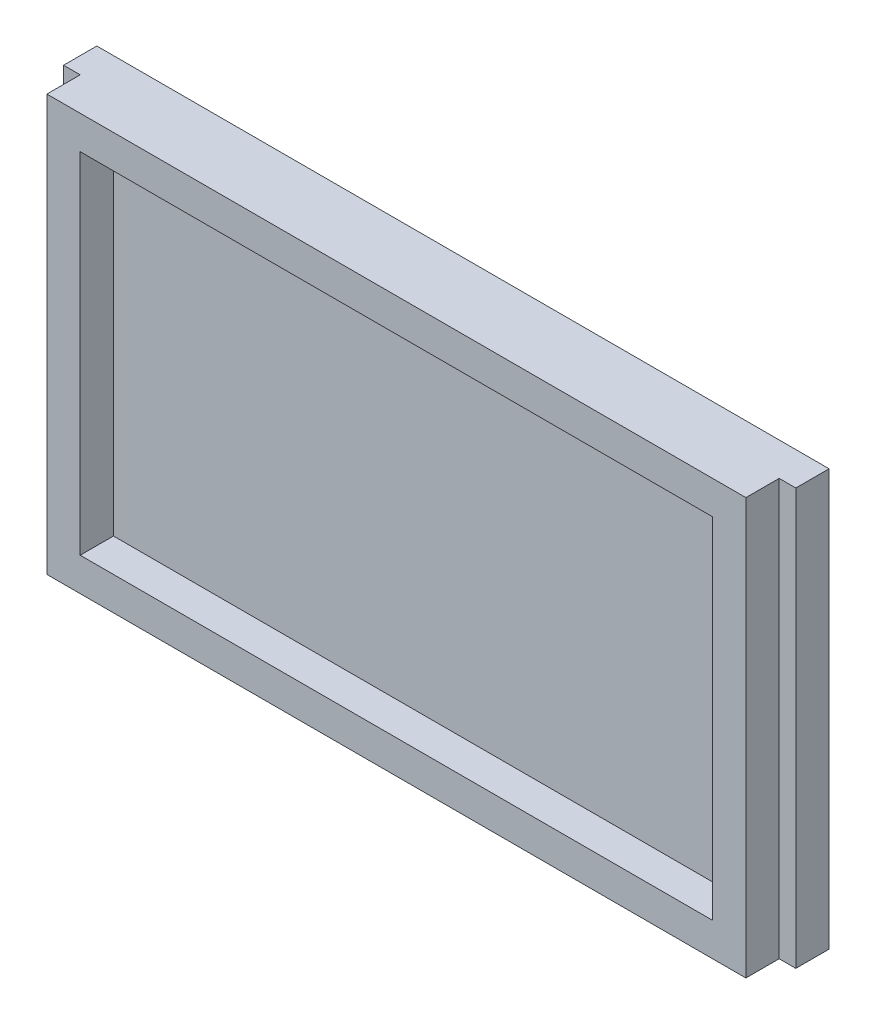
from build123d import *

# Parameters (mm, degrees)
IZIM1_W                     = 44
IZIM1_H                     = 25
Y_KSEKLIK_EKSTR_ZYON1_DEPTH = 2
IZIM3_W                     = 42
IZIM3_H                     = 25
Y_KSEKLIK_EKSTR_ZYON2_DEPTH = 2
IZIM5_W                     = 38
IZIM5_H                     = 21
KES_EKSTR_ZYON1_DEPTH       = 2


with BuildPart() as part:
    # Çizim1 → Yükseklik-Ekstrüzyon1 (new body)
    with BuildSketch(Plane.XY):
        Rectangle(IZIM1_W, IZIM1_H)
    extrude(amount=Y_KSEKLIK_EKSTR_ZYON1_DEPTH)

    # Çizim3 → Yükseklik-Ekstrüzyon2 (add)
    with BuildSketch(Plane.XY.offset(2)):
        Rectangle(IZIM3_W, IZIM3_H)
    extrude(amount=Y_KSEKLIK_EKSTR_ZYON2_DEPTH)

    # Çizim5 → Kes-Ekstrüzyon1 (cut)
    with BuildSketch(Plane.XY.offset(4)):
        Rectangle(IZIM5_W, IZIM5_H)
    extrude(amount=-KES_EKSTR_ZYON1_DEPTH, mode=Mode.SUBTRACT)


solid = part.part
